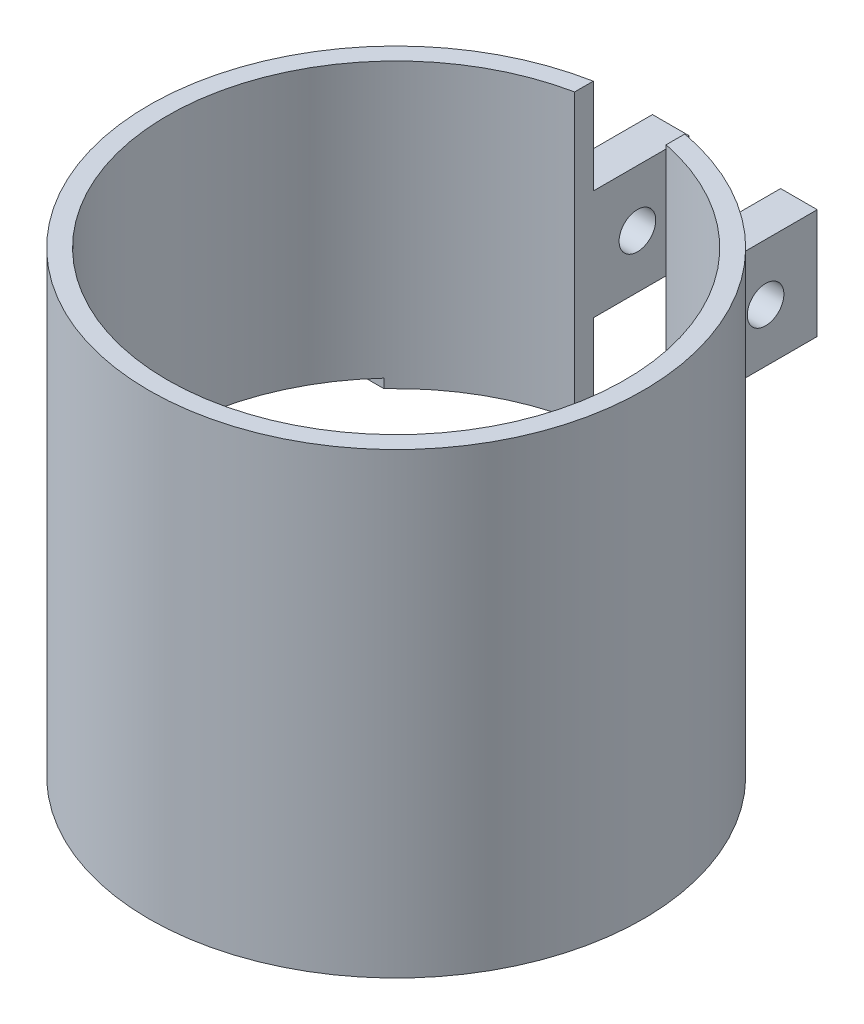
from build123d import *

# Parameters (mm, degrees)
SKETCH1_R                       = 13.5
BOSS_EXTRUDE1_DEPTH             = 25
SKETCH2_R                       = 12.5
CUT_EXTRUDE1_DEPTH              = 24
SKETCH3_W                       = 17
SKETCH3_H                       = 8
CUT_EXTRUDE2_DEPTH              = 9
CUT_EXTRUDE3_DEPTH              = 9
SKETCH5_W                       = 2
SKETCH5_H                       = 6
BOSS_EXTRUDE2_DEPTH             = 5
BOSS_EXTRUDE2_DIRECTION_2_REACH = 41.195
SKETCH6_R                       = 1
CUT_EXTRUDE4_DEPTH              = 2


with BuildPart() as part:
    # Sketch1 → Boss-Extrude1 (new body)
    with BuildSketch(Plane(origin=(0, 0, 0), x_dir=(1, 0, 0), z_dir=(0, 1, 0))):
        with Locations(Location((0, 0, 0), (0, 0, 270))):
            Circle(SKETCH1_R)
    extrude(amount=BOSS_EXTRUDE1_DEPTH)

    # Sketch2 → Cut-Extrude1 (cut)
    with BuildSketch(Plane(origin=(0, 25, 0), x_dir=(1, 0, 0), z_dir=(0, 1, 0))):
        with Locations(Location((0, 0, 0), (0, 0, 270))):
            Circle(SKETCH2_R)
    extrude(amount=-CUT_EXTRUDE1_DEPTH, mode=Mode.SUBTRACT)

    # Sketch3 → Cut-Extrude2 (cut)
    with BuildSketch(Plane.ZY.offset(13.5)):
        with Locations((0, 6)):
            Rectangle(SKETCH3_W, SKETCH3_H)
    extrude(amount=-CUT_EXTRUDE2_DEPTH, mode=Mode.SUBTRACT)

    # Sketch4 → Cut-Extrude3 (cut)
    with BuildSketch(Plane(origin=(0, 0, -13.5), x_dir=(-1, 0, 0), z_dir=(0, 0, -1))):
        Polygon((2.5, 25), (-2.5, 25), (-2.5, 9.5), (-2.5, 6.5), (10.5, 6.5), (10.5, 9.5), (2.5, 9.5), align=None)
    extrude(amount=-CUT_EXTRUDE3_DEPTH, mode=Mode.SUBTRACT)

    # Sketch5 → Boss-Extrude2 (add)
    with BuildSketch(Plane(origin=(0, 0, -13.5), x_dir=(-1, 0, 0), z_dir=(0, 0, -1))):
        with Locations((3.5, 16.80292759)):
            Rectangle(SKETCH5_W, SKETCH5_H)
    boss_extrude2 = extrude(amount=BOSS_EXTRUDE2_DEPTH)

    # Sketch5 → Boss-Extrude2 direction 2 (add, up to next)
    with BuildSketch(Plane(origin=(0, 0, -13.5), x_dir=(-1, 0, 0), z_dir=(0, 0, -1)), mode=Mode.PRIVATE) as boss_extrude2_direction_2_sk1:
        with Locations((3.5, 16.80292759)):
            Rectangle(SKETCH5_W, SKETCH5_H)
    boss_extrude2_direction_2_tool1 = extrude(boss_extrude2_direction_2_sk1.sketch, amount=-BOSS_EXTRUDE2_DIRECTION_2_REACH, mode=Mode.PRIVATE) - part.part
    boss_extrude2_direction_2 = boss_extrude2_direction_2_tool1.solids().sort_by_distance((-3.5, 16.802928, -13.5))[0]
    add(boss_extrude2_direction_2)

    # Sketch6 → Cut-Extrude4 (cut)
    with BuildSketch(Plane(origin=(-2.5, 0, 0), x_dir=(0, 0, -1), z_dir=(1, 0, 0))):
        with Locations(Location((15.677904261, 16.72055598, 0), (0, 0, 90))):
            Circle(SKETCH6_R)
    cut_extrude4 = extrude(amount=-CUT_EXTRUDE4_DEPTH, mode=Mode.SUBTRACT)

    # Mirror1: Boss-Extrude2, Boss-Extrude2 direction 2, Cut-Extrude4 across plane
    add(boss_extrude2.mirror(Plane(origin=(0, 0, 0), x_dir=(0, 0, 1), z_dir=(1, 0, 0))))
    add(boss_extrude2_direction_2.mirror(Plane(origin=(0, 0, 0), x_dir=(0, 0, 1), z_dir=(1, 0, 0))))
    add(cut_extrude4.mirror(Plane(origin=(0, 0, 0), x_dir=(0, 0, 1), z_dir=(1, 0, 0))), mode=Mode.SUBTRACT)


solid = part.part
